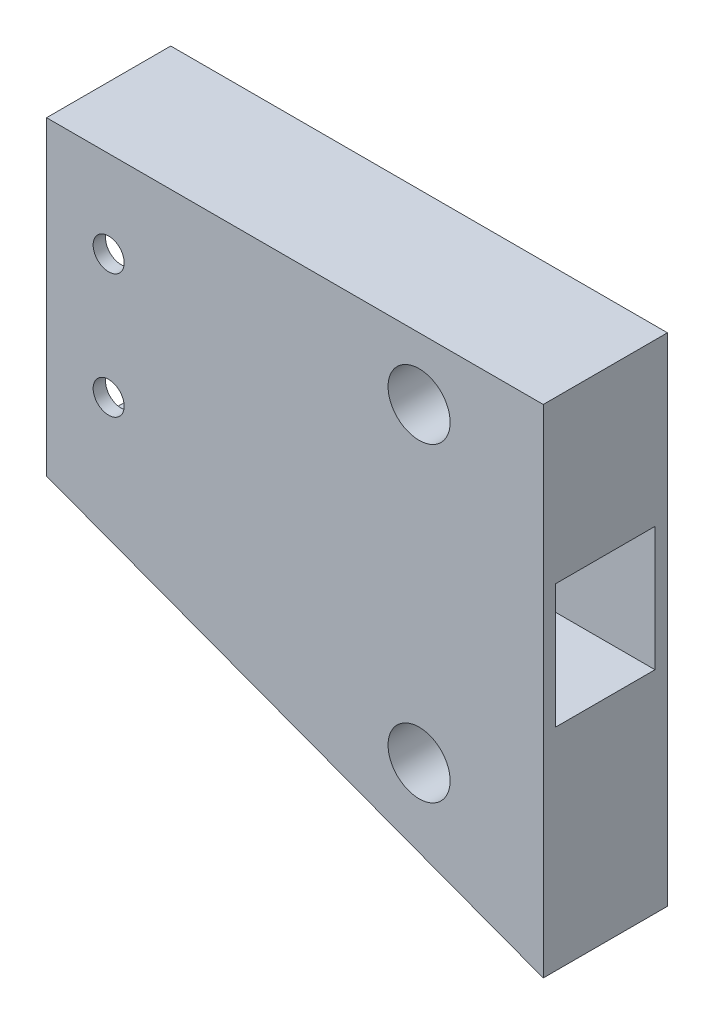
from build123d import *

# Parameters (mm, degrees)
BOSS_EXTRUDE1_DEPTH = 10
SKETCH2_W           = 8
SKETCH2_H           = 20
CUT_EXTRUDE1_DEPTH  = 20
SKETCH3_W           = 8
SKETCH3_H           = 10
CUT_EXTRUDE2_DEPTH  = 34.541019662
SKETCH4_R           = 1.25
SKETCH4_R_2         = 2.5
CUT_EXTRUDE3_DEPTH  = 10


with BuildPart() as part:
    # Sketch1 → Boss-Extrude1 (new body)
    with BuildSketch(Plane.XY):
        Polygon((0, 0), (40, -15), (40, 25), (0, 25), align=None)
    extrude(amount=BOSS_EXTRUDE1_DEPTH)

    # Sketch2 → Cut-Extrude1 (cut)
    with BuildSketch(Plane.ZY):
        with Locations((5, 12)):
            Rectangle(SKETCH2_W, SKETCH2_H)
    extrude(amount=-CUT_EXTRUDE1_DEPTH, mode=Mode.SUBTRACT)

    # Sketch3 → Cut-Extrude2 (cut, through all)
    with BuildSketch(Plane.ZY.offset(-20)):
        with Locations((5, 7)):
            Rectangle(SKETCH3_W, SKETCH3_H)
    extrude(amount=-CUT_EXTRUDE2_DEPTH, mode=Mode.SUBTRACT)

    # Sketch4 → Cut-Extrude3 (cut)
    with BuildSketch(Plane.XY.offset(10)):
        with Locations((5, 18)):
            Circle(SKETCH4_R)
        with Locations((5, 8)):
            Circle(SKETCH4_R)
        with Locations((30, 20)):
            Circle(SKETCH4_R_2)
        with Locations((30, -5)):
            Circle(SKETCH4_R_2)
    extrude(amount=-CUT_EXTRUDE3_DEPTH, mode=Mode.SUBTRACT)


solid = part.part
